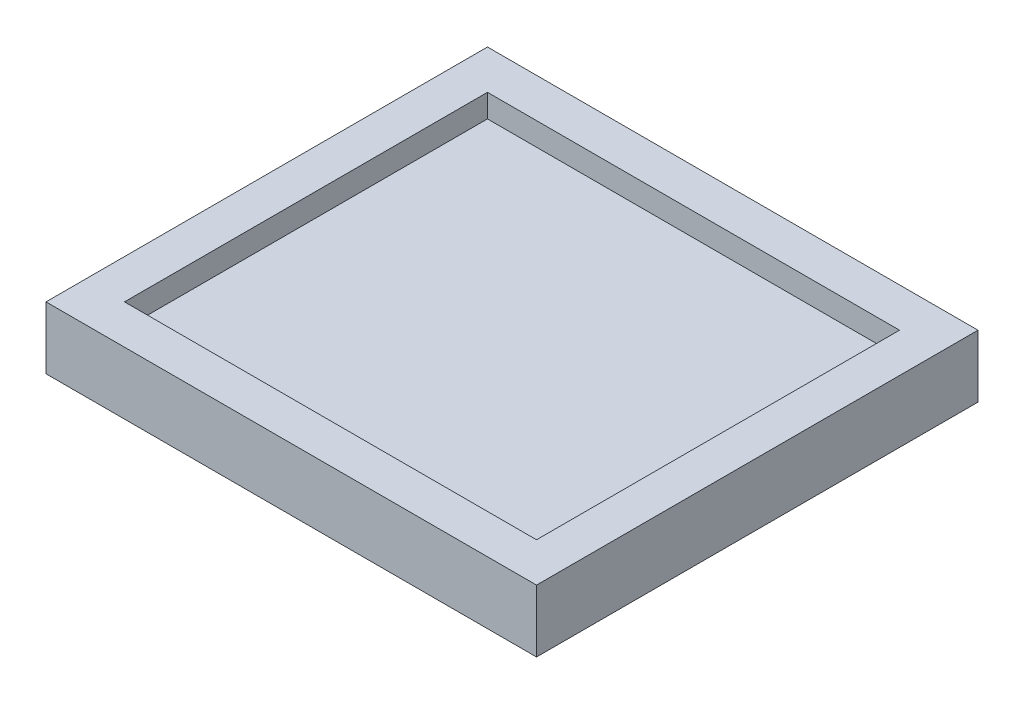
from build123d import *

# Parameters (mm, degrees)
SKETCH1_W           = 100
SKETCH1_H           = 90
BOSS_EXTRUDE1_DEPTH = 12.7
SHELL1_T            = -8


with BuildPart() as part:
    # Sketch1 → Boss-Extrude1 (new body)
    with BuildSketch(Plane(origin=(0, 0, 0), x_dir=(1, 0, 0), z_dir=(0, 1, 0))):
        Rectangle(SKETCH1_W, SKETCH1_H)
    extrude(amount=BOSS_EXTRUDE1_DEPTH)

    # Shell1
    shell1_openings = [part.faces().sort_by_distance(p)[0] for p in [
        (0, 12.7, 0),
    ]]
    offset(amount=SHELL1_T, openings=shell1_openings, kind=Kind.INTERSECTION)


solid = part.part
